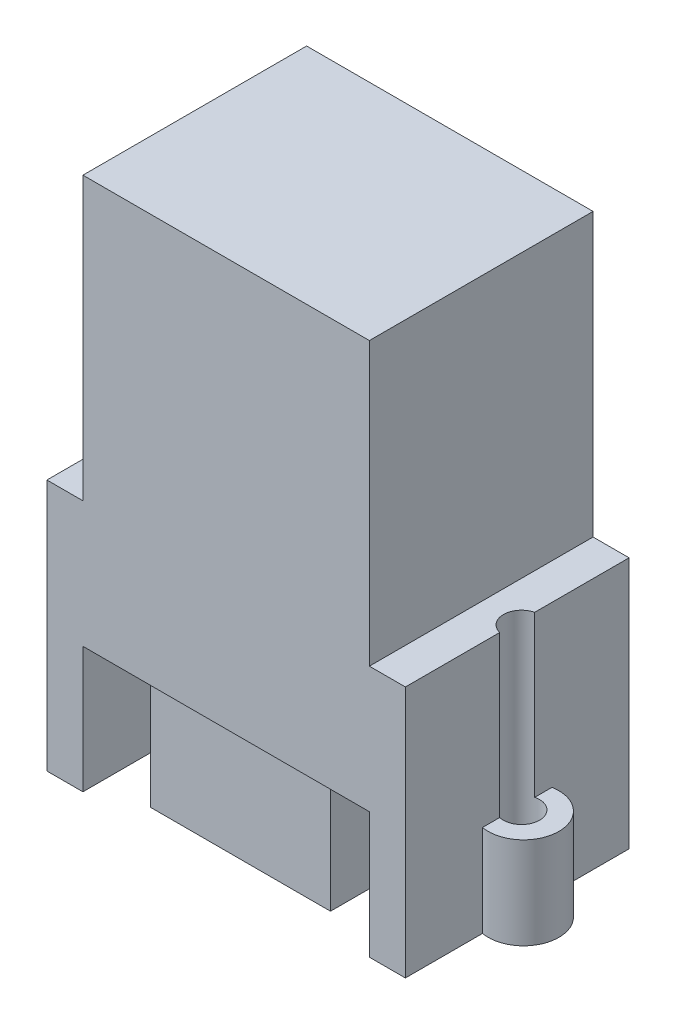
from build123d import *

# Parameters (mm, degrees)
SKETCH1_W           = 15
SKETCH1_H           = 16.25
BOSS_EXTRUDE1_DEPTH = 10
SKETCH2_W           = 11.171160898
SKETCH2_H           = 3.40778749
SKETCH2_H_2         = 3.38965483
CUT_EXTRUDE1_DEPTH  = 10
SKETCH3_W           = 23.87
SKETCH3_H           = 18.64
BOSS_EXTRUDE2_DEPTH = 34
SKETCH4_W           = 18.64
SKETCH4_H           = 21.002535876
BOSS_EXTRUDE3_DEPTH = 3
SKETCH5_R           = 2.94201074
BOSS_EXTRUDE4_DEPTH = 7.65
SKETCH6_R           = 1.5
CUT_EXTRUDE2_DEPTH  = 49.595866638


with BuildPart() as part:
    # Sketch1 → Boss-Extrude1 (new body)
    with BuildSketch(Plane(origin=(0, 0, 0), x_dir=(1, 0, 0), z_dir=(0, 1, 0))):
        Rectangle(SKETCH1_W, SKETCH1_H)
    extrude(amount=-BOSS_EXTRUDE1_DEPTH)

    # Sketch2 → Cut-Extrude1 (cut)
    with BuildSketch(Plane(origin=(0, 0, 0), x_dir=(1, 0, 0), z_dir=(0, 1, 0))):
        with Locations((0, 5.398551248)):
            Rectangle(SKETCH2_W, SKETCH2_H)
        with Locations((0, -3.591791831)):
            Rectangle(SKETCH2_W, SKETCH2_H_2)
    extrude(amount=-CUT_EXTRUDE1_DEPTH, mode=Mode.SUBTRACT)

    # Sketch3 → Boss-Extrude2 (add)
    with BuildSketch(Plane(origin=(0, 0, 0), x_dir=(1, 0, 0), z_dir=(0, 1, 0))):
        Rectangle(SKETCH3_W, SKETCH3_H)
    extrude(amount=BOSS_EXTRUDE2_DEPTH)

    # Sketch4 → Boss-Extrude3 (add)
    with BuildSketch(Plane.ZY.offset(11.935)):
        Rectangle(SKETCH4_W, SKETCH4_H)
    boss_extrude3 = extrude(amount=BOSS_EXTRUDE3_DEPTH)

    # Sketch5 → Boss-Extrude4 (add)
    with BuildSketch(Plane(origin=(0, -10.501267938, 0), x_dir=(-1, 0, 0), z_dir=(0, -1, 0))):
        with Locations((15.461680584, 0)):
            Circle(SKETCH5_R)
    boss_extrude4 = extrude(amount=-BOSS_EXTRUDE4_DEPTH)

    # Mirror1: Boss-Extrude3, Boss-Extrude4 across plane
    add(boss_extrude3.mirror(Plane(origin=(0, 0, 0), x_dir=(0, 0, 1), z_dir=(1, 0, 0))))
    add(boss_extrude4.mirror(Plane(origin=(0, 0, 0), x_dir=(0, 0, 1), z_dir=(1, 0, 0))))

    # Sketch6 → Cut-Extrude2 (cut, symmetric)
    with BuildSketch(Plane(origin=(0, -10, 0), x_dir=(-1, 0, 0), z_dir=(0, -1, 0))):
        with Locations(Location((15.29, 0, 0), (0, 0, 90))):
            Circle(SKETCH6_R)
    cut_extrude2 = extrude(amount=CUT_EXTRUDE2_DEPTH, both=True, mode=Mode.SUBTRACT)

    # Mirror2: Cut-Extrude2 across plane
    add(cut_extrude2.mirror(Plane(origin=(0, 0, 0), x_dir=(0, 0, 1), z_dir=(1, 0, 0))), mode=Mode.SUBTRACT)


solid = part.part
